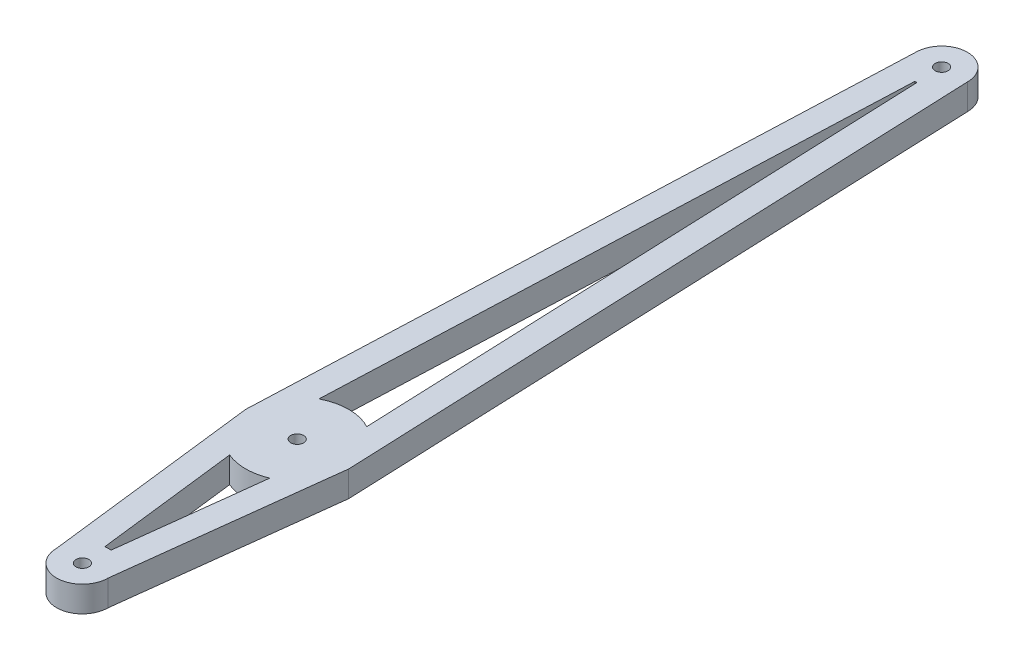
from build123d import *

# Parameters (mm, degrees)
SKETCH1_R           = 1.5
BOSS_EXTRUDE4_DEPTH = 6


with BuildPart() as part:
    # Sketch1 → Boss-Extrude4 (new body)
    with BuildSketch(Plane(origin=(0, 0, 0), x_dir=(1, 0, 0), z_dir=(0, 1, 0))):
        with BuildLine():
            Line((12, 0), (6, 150))
            ThreePointArc((6, 150), (0, 156), (-6, 150))
            Line((-6, 150), (-12, 0))
            Line((-12, 0), (-6, -50))
            ThreePointArc((-6, -50), (0, -56), (6, -50))
            Line((6, -50), (12, 0))
        make_face()
        with Locations(Location((0, 0, 0), (0, 0, 270))):
            Circle(SKETCH1_R, mode=Mode.SUBTRACT)
        with BuildLine():
            Line((-0.714871324, -44.042738969), (-4.673707022, -11.05244148))
            ThreePointArc((-4.673707022, -11.05244148), (0, -12), (4.673707022, -11.05244148))
            Line((4.673707022, -11.05244148), (0.714871324, -44.042738969))
            ThreePointArc((0.714871324, -44.042738969), (0, -44), (-0.714871324, -44.042738969))
        make_face(mode=Mode.SUBTRACT)
        with BuildLine():
            Line((0.23980823, 144.004794248), (5.574944726, 10.626381854))
            ThreePointArc((5.574944726, 10.626381854), (0, 12), (-5.574944726, 10.626381854))
            Line((-5.574944726, 10.626381854), (-0.23980823, 144.004794248))
            ThreePointArc((-0.23980823, 144.004794248), (0, 144), (0.23980823, 144.004794248))
        make_face(mode=Mode.SUBTRACT)
        with Locations(Location((0, 150, 0), (0, 0, 270))):
            Circle(SKETCH1_R, mode=Mode.SUBTRACT)
        with Locations(Location((0, -50, 0), (0, 0, 270))):
            Circle(SKETCH1_R, mode=Mode.SUBTRACT)
    extrude(amount=BOSS_EXTRUDE4_DEPTH)


solid = part.part
